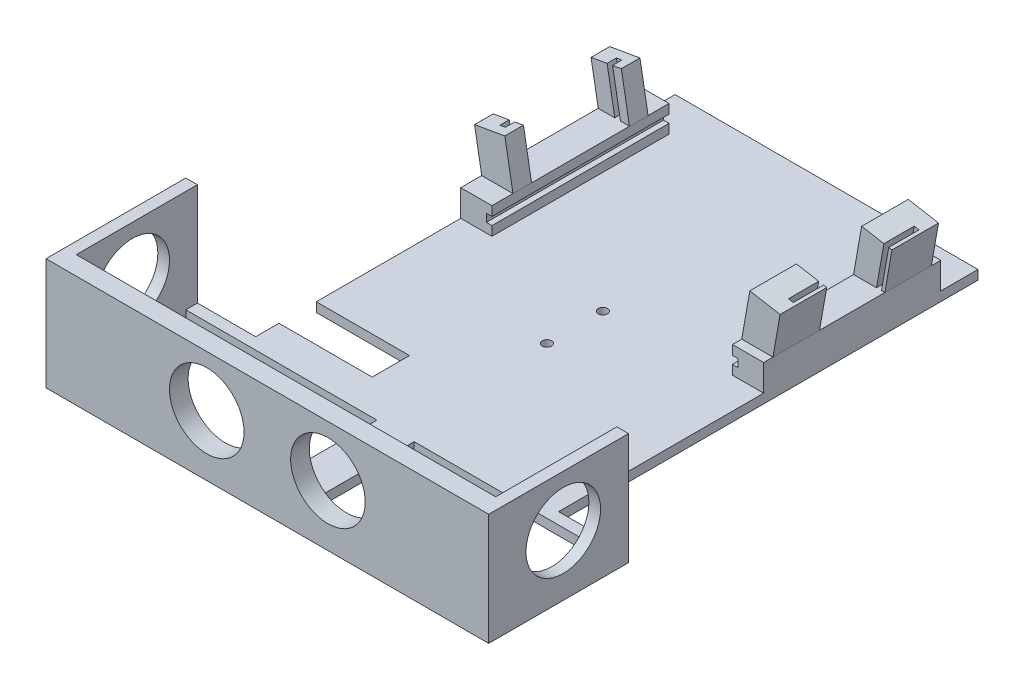
from build123d import *

# Parameters (mm, degrees)
SKETCH1_W            = 95
SKETCH1_H            = 22
SKETCH1_R            = 8
BOSS_EXTRUDE1_DEPTH  = 4
SKETCH2_W            = 41
SKETCH2_H            = 23.5
BOSS_EXTRUDE2_DEPTH  = 2
BOSS_EXTRUDE3_START  = -70
BOSS_EXTRUDE3_DEPTH  = 38
BOSS_EXTRUDE5_DEPTH  = 10
BOSS_EXTRUDE6_DEPTH  = 10
SKETCH10_R           = 1
CUT_EXTRUDE1_DEPTH   = 4
BOSS_EXTRUDE11_START = 45
SKETCH11_W           = 30
SKETCH11_H           = 24
SKETCH11_R           = 8
BOSS_EXTRUDE11_DEPTH = 2.5
BOSS_EXTRUDE12_START = -47.5
SKETCH11_2_W         = 30
SKETCH11_2_H         = 24
SKETCH11_2_R         = 8
BOSS_EXTRUDE12_DEPTH = 2.5


with BuildPart() as part:
    # Sketch1 → Boss-Extrude1 (new body)
    with BuildSketch(Plane.XY):
        Rectangle(SKETCH1_W, SKETCH1_H)
        with Locations((-13, 0)):
            Circle(SKETCH1_R, mode=Mode.SUBTRACT)
        with Locations((13, 0)):
            Circle(SKETCH1_R, mode=Mode.SUBTRACT)
    extrude(amount=BOSS_EXTRUDE1_DEPTH)

    # Sketch2 → Boss-Extrude2 (add)
    with BuildSketch(Plane(origin=(0, -11, 0), x_dir=(-1, 0, 0), z_dir=(0, -1, 0))):
        Polygon((-32.5, 116), (32.5, 116), (32.5, 39), (12.5, 39), (12.5, 31), (32.5, 31), (32.5, 26), (47.5, 26), (47.5, -4), (32.5, -4), (-32.5, -4), (-47.5, -4), (-47.5, 26), (-32.5, 26), align=None)
        with Locations((-24.5, 11.75)):
            Rectangle(SKETCH2_W, SKETCH2_H, mode=Mode.SUBTRACT)
        with Locations((24.5, 11.75)):
            Rectangle(SKETCH2_W, SKETCH2_H, mode=Mode.SUBTRACT)
    extrude(amount=BOSS_EXTRUDE2_DEPTH)

    # Sketch4 → Boss-Extrude3 (add)
    with BuildSketch(Plane.XY.offset(BOSS_EXTRUDE3_START)):
        Polygon((-25.8, -11), (-25.8, -9), (-27, -9), (-27, -7.3), (-25.8, -7.3), (-25.8, -5.3), (-32.5, -5.3), (-32.5, -11), align=None)
        Polygon((32.5, -5.3), (32.5, -11), (25.8, -11), (25.8, -9), (27, -9), (27, -7.3), (25.8, -7.3), (25.8, -5.3), align=None)
    extrude(amount=-BOSS_EXTRUDE3_DEPTH)

    # Sketch7 → Boss-Extrude5 (add)
    with BuildSketch(Plane(origin=(0.128388188, -0.728125596, 0), x_dir=(0, 0, 1), z_dir=(-0.17364817766693402, 0.9848077530122075, 0))):
        Polygon((-74.5, -26.328375369), (-74.5, -32.926587315), (-78.5, -32.926587315), (-78.5, -29.426587315), (-76.5, -29.426587315), (-76.5, -28.226587315), (-78.5, -28.226587315), (-78.5, -26.328375369), align=None)
        Polygon((-101.5, -28.226587315), (-99.5, -28.226587315), (-99.5, -26.328375369), (-103.5, -26.328375369), (-103.5, -32.926587315), (-99.5, -32.926587315), (-99.5, -29.426587315), (-101.5, -29.426587315), align=None)
    extrude(amount=BOSS_EXTRUDE5_DEPTH)

    # Sketch8 → Boss-Extrude6 (add)
    with BuildSketch(Plane(origin=(-0.128388188, -0.728125596, 0), x_dir=(0, 0, 1), z_dir=(0.17364817766692736, 0.9848077530122086, 0))):
        Polygon((-82, 26.328375369), (-82, 31.176587315), (-75.5, 31.176587315), (-75.5, 32.226587315), (-82, 32.226587315), (-82, 32.926587315), (-72, 32.926587315), (-72, 26.328375369), align=None)
        Polygon((-96, 32.226587315), (-96, 32.926587315), (-106, 32.926587315), (-106, 26.328375369), (-96, 26.328375369), (-96, 31.176587315), (-102.5, 31.176587315), (-102.5, 32.226587315), align=None)
    extrude(amount=BOSS_EXTRUDE6_DEPTH)

    # Sketch10 → Cut-Extrude1 (cut)
    with BuildSketch(Plane.XZ.offset(13)):
        with Locations((0, -56)):
            Circle(SKETCH10_R)
        with Locations((0, -68)):
            Circle(SKETCH10_R)
    extrude(amount=-CUT_EXTRUDE1_DEPTH, mode=Mode.SUBTRACT)

    # Sketch11 → Boss-Extrude11 (add)
    with BuildSketch(Plane(origin=(0, 0, 0), x_dir=(0, 0, -1), z_dir=(1, 0, 0)).offset(BOSS_EXTRUDE11_START)):
        with Locations((11, -1)):
            Rectangle(SKETCH11_W, SKETCH11_H)
        with Locations((12, 0)):
            Circle(SKETCH11_R, mode=Mode.SUBTRACT)
    extrude(amount=BOSS_EXTRUDE11_DEPTH)

    # Sketch11<2> → Boss-Extrude12 (add)
    with BuildSketch(Plane(origin=(0, 0, 0), x_dir=(0, 0, -1), z_dir=(1, 0, 0)).offset(BOSS_EXTRUDE12_START)):
        with Locations((11, -1)):
            Rectangle(SKETCH11_2_W, SKETCH11_2_H)
        with Locations((12, 0)):
            Circle(SKETCH11_2_R, mode=Mode.SUBTRACT)
    extrude(amount=BOSS_EXTRUDE12_DEPTH)


solid = part.part
